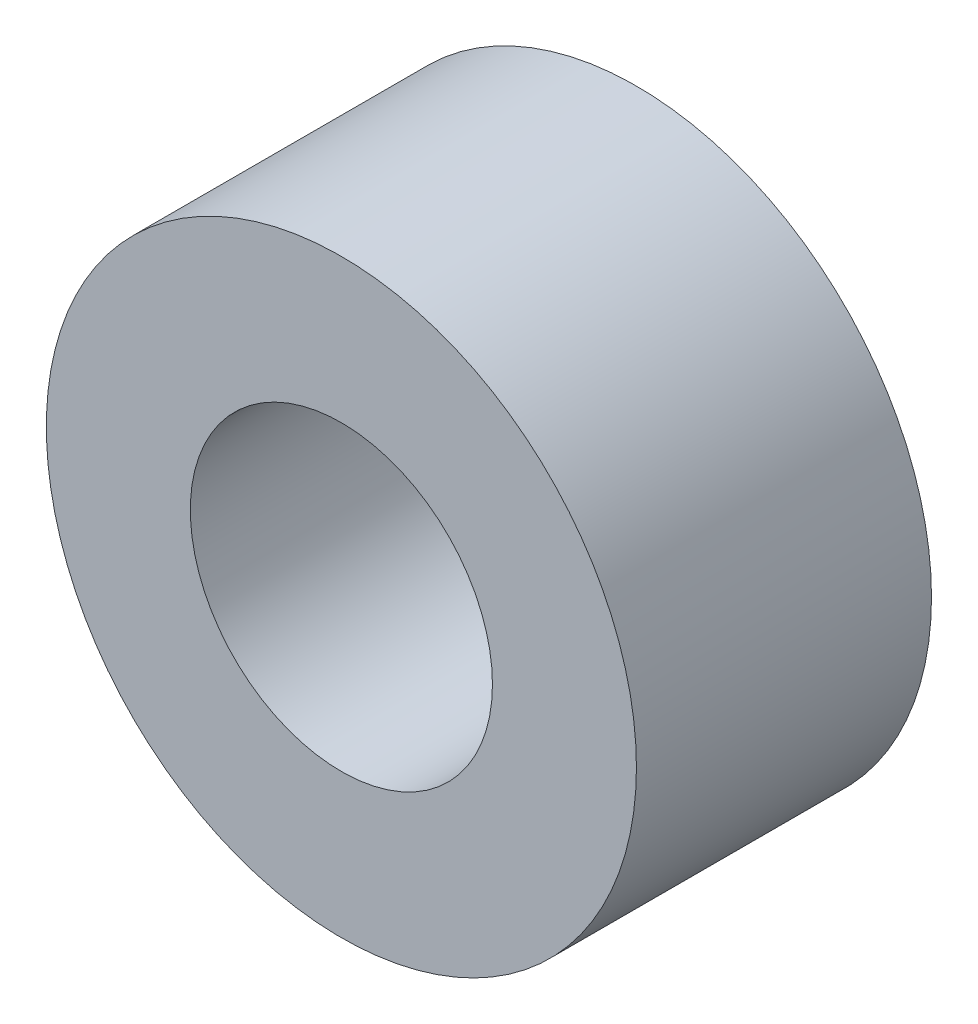
from build123d import *

# Parameters (mm, degrees)
SKETCH1_R      = 1.5875
SKETCH1_R_2    = 0.8128
EXTRUDE1_DEPTH = 0.79375


with BuildPart() as part:
    # Sketch1 → Extrude1 (new, symmetric)
    with BuildSketch(Plane.XY):
        Circle(SKETCH1_R)
        Circle(SKETCH1_R_2, mode=Mode.SUBTRACT)
    extrude(amount=EXTRUDE1_DEPTH, both=True)


solid = part.part
